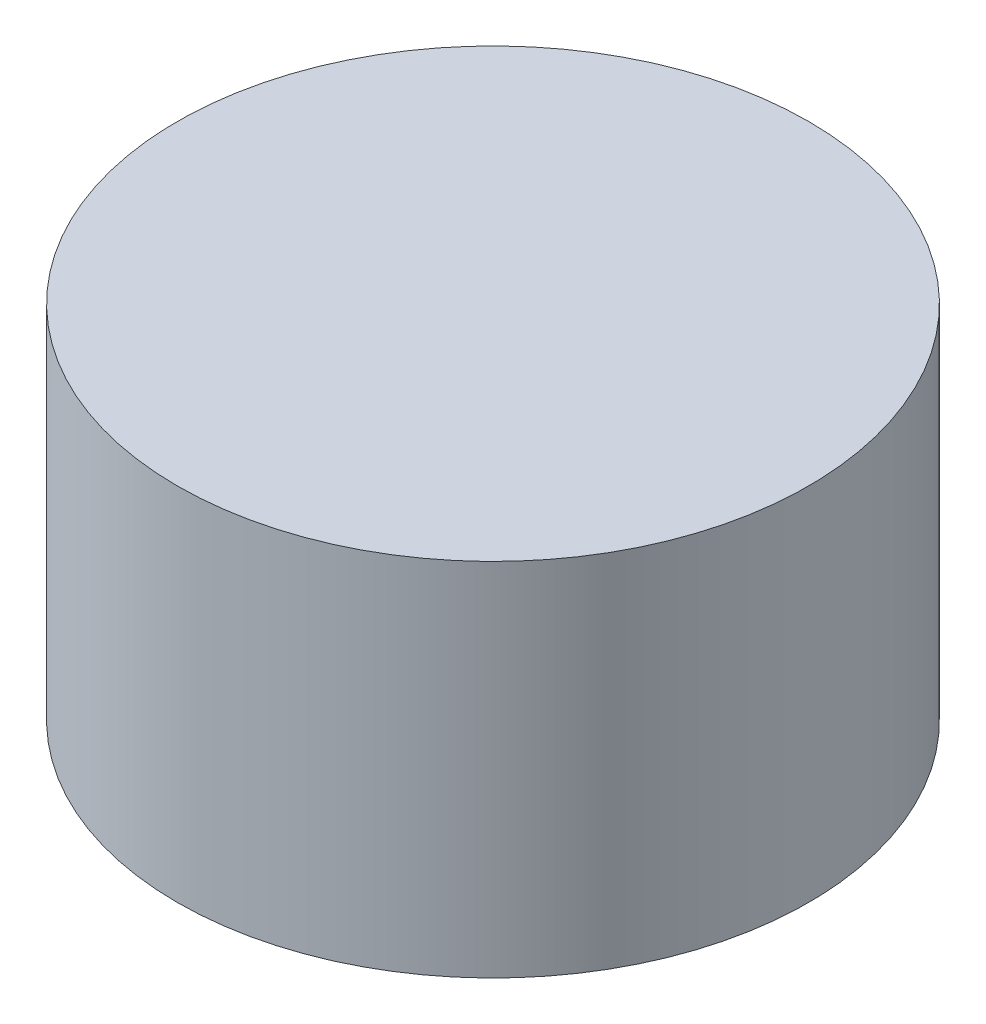
from build123d import *

# Parameters (mm, degrees)
SKETCH2_W = 22.225
SKETCH2_H = 25.4


with BuildPart() as part:
    # Sketch2 → Body (revolve)
    with BuildSketch(Plane.XY, mode=Mode.PRIVATE) as body_sk:
        with Locations((-11.1125, 12.7)):
            Rectangle(SKETCH2_W, SKETCH2_H)
    revolve(body_sk.sketch.rotate(Axis((0, 0, 0), (0, 1, 0)), 270), axis=Axis((0, 0, 0), (0, 1, 0)))


solid = part.part
